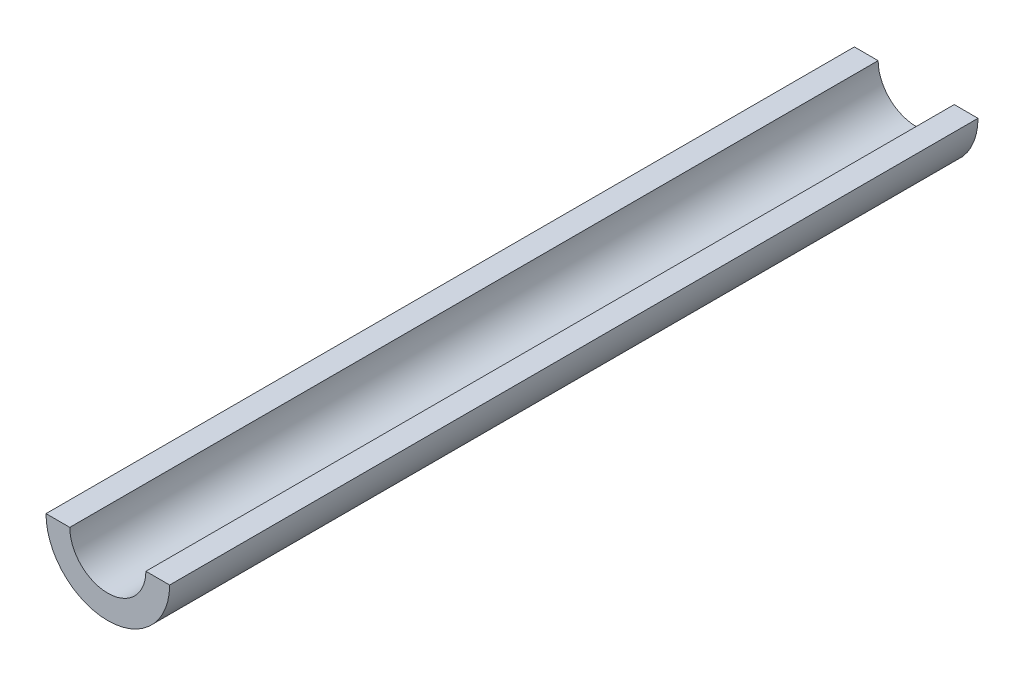
from build123d import *

# Parameters (mm, degrees)
BOSS_EXTRUDE1_DEPTH = 170


with BuildPart() as part:
    # Sketch2 → Boss-Extrude1 (new body)
    with BuildSketch(Plane.XY):
        with BuildLine():
            Line((-13, 0), (-8, 0))
            ThreePointArc((-8, 0), (0, -8), (8, 0))
            Line((8, 0), (13, 0))
            ThreePointArc((13, 0), (0, -13), (-13, 0))
        make_face()
    extrude(amount=BOSS_EXTRUDE1_DEPTH)


solid = part.part
